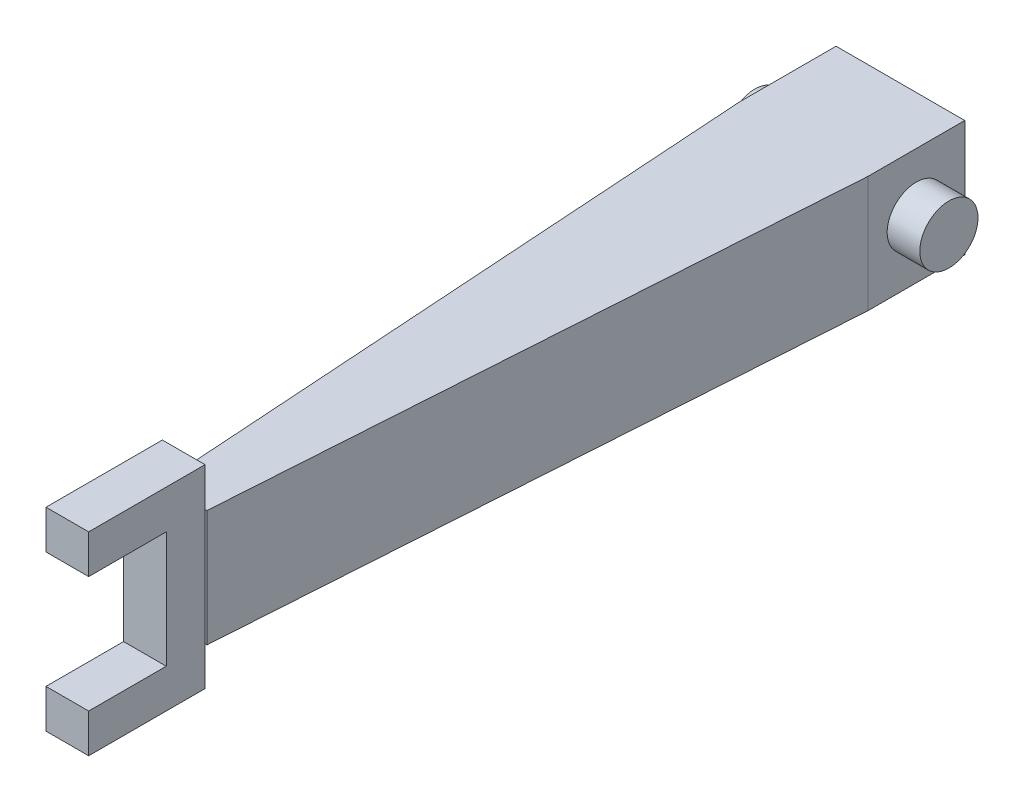
from build123d import *

# Parameters (mm, degrees)
BOSS_EXTRUDE2_DEPTH = 30
SKETCH4_R           = 7.5
BOSS_EXTRUDE3_DEPTH = 25
BOSS_EXTRUDE4_DEPTH = 5.5


with BuildPart() as part:
    # Sketch1 → Boss-Extrude2 (new body)
    with BuildSketch(Plane(origin=(0, 0, 0), x_dir=(1, 0, 0), z_dir=(0, 1, 0))):
        Polygon((-16.585, 0), (-5.986840434, -159.755193945), (5.986840434, -159.755193945), (16.585, 0), (16.585, 25), (-16.585, 25), align=None)
    extrude(amount=BOSS_EXTRUDE2_DEPTH)

    # Sketch4 → Boss-Extrude3 (add, symmetric)
    with BuildSketch(Plane(origin=(0, 0, 0), x_dir=(0, 0, -1), z_dir=(1, 0, 0))):
        with Locations((12.5, 15)):
            Circle(SKETCH4_R)
    extrude(amount=BOSS_EXTRUDE3_DEPTH, both=True)

    # Sketch6 → Boss-Extrude4 (add, symmetric)
    with BuildSketch(Plane(origin=(0, 0, 0), x_dir=(0, 0, -1), z_dir=(1, 0, 0))):
        Polygon((-189.755193945, 40), (-159.755193945, 40), (-159.755193945, -10), (-189.755193945, -10), (-189.755193945, 0), (-169.755193945, 0), (-169.755193945, 30), (-189.755193945, 30), align=None)
    extrude(amount=BOSS_EXTRUDE4_DEPTH, both=True)


solid = part.part
